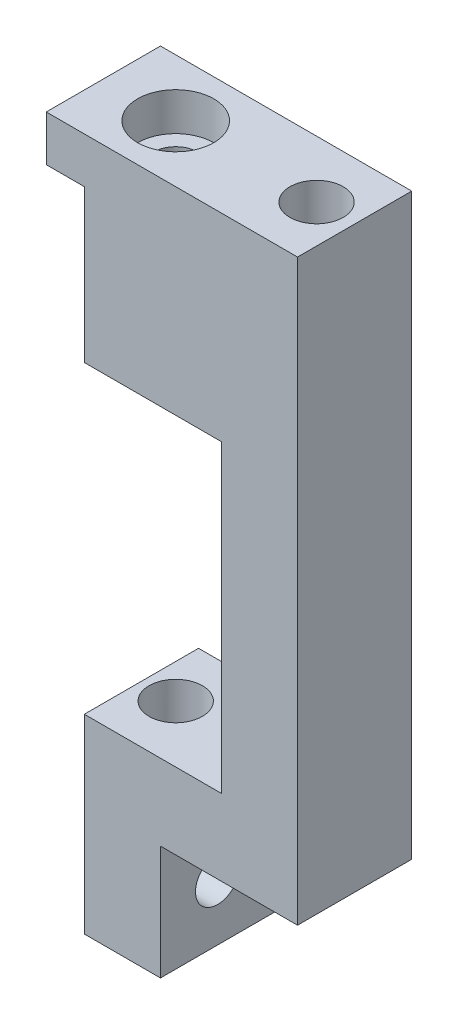
from build123d import *

# Parameters (mm, degrees)
BOSS_EXTRUDE1_DEPTH          = 7.5
CUT_EXTRUDE1_REACH           = 158.924
SKETCH2_W                    = 18
SKETCH2_H                    = 40
M5_CLEARANCE_HOLE1_D         = 5.8
CUT_EXTRUDE2_REACH           = 158.924
F_7_0_7_DIAMETER_HOLE1_D     = 7
F_7_0_7_DIAMETER_HOLE1_DEPTH = 20
MOVE_FACE1_BY                = 0.6
CUT_EXTRUDE3_REACH           = 141.732
SKETCH14_W                   = 15
SKETCH14_H                   = 15
BOSS_EXTRUDE2_DEPTH          = 10
M5_CLEARANCE_HOLE2_D         = 5.8
SKETCH18_W                   = 33
SKETCH18_H                   = 15
SKETCH18_R                   = 5
BOSS_EXTRUDE3_DEPTH          = 6
SKETCH19_R                   = 5
SKETCH19_R_2                 = 2.9
BOSS_EXTRUDE4_DEPTH          = 1
F_7_0_7_DIAMETER_HOLE2_D     = 7
F_7_0_7_DIAMETER_HOLE2_DEPTH = 30


with BuildPart() as part:
    # Sketch1 → Boss-Extrude1 (new, symmetric)
    with BuildSketch(Plane.XY):
        Polygon((0, 0), (120, 0), (0, -100), align=None)
    extrude(amount=BOSS_EXTRUDE1_DEPTH, both=True)

    # Sketch2 → Cut-Extrude1 (cut, up to next)
    with BuildSketch(Plane.XY.offset(7.5), mode=Mode.PRIVATE) as cut_extrude1_sk1:
        with Locations((9, -40)):
            Rectangle(SKETCH2_W, SKETCH2_H)
    cut_extrude1_tool1 = extrude(cut_extrude1_sk1.sketch, amount=-CUT_EXTRUDE1_REACH, mode=Mode.PRIVATE) & part.part
    add(cut_extrude1_tool1.solids().sort_by_distance((9, -40, 7.5))[0], mode=Mode.SUBTRACT)

    # M5 Clearance Hole1 (through all)
    with Locations(Plane(origin=(0, 0, 0), x_dir=(1, 0, 0), z_dir=(0, 1, 0))):
        with Locations((4.5, 0)):
            Hole(M5_CLEARANCE_HOLE1_D / 2)

    # Sketch8 → Cut-Extrude2 (cut, up to next)
    with BuildSketch(Plane.XY.offset(7.5), mode=Mode.PRIVATE) as cut_extrude2_sk1:
        Polygon((0, -70), (36, -70), (0, -100), align=None)
    cut_extrude2_tool1 = extrude(cut_extrude2_sk1.sketch, amount=-CUT_EXTRUDE2_REACH, mode=Mode.PRIVATE) & part.part
    add(cut_extrude2_tool1.solids().sort_by_distance((12, -80, 7.5))[0], mode=Mode.SUBTRACT)

    # Ø7.0 (7) Diameter Hole1
    with Locations(Plane(origin=(0, 0, 0), x_dir=(1, 0, 0), z_dir=(0, 1, 0))):
        with Locations((60, 0)):
            Hole(F_7_0_7_DIAMETER_HOLE1_D / 2, depth=F_7_0_7_DIAMETER_HOLE1_DEPTH)

    # Move Face1: a curved face moved inward by 0.6
    add(Solid.thicken(part.faces().sort_by_distance((7.4, -65, 0))[0], -MOVE_FACE1_BY), mode=Mode.SUBTRACT)

    # Sketch13 → Cut-Extrude3 (cut, up to next)
    with BuildSketch(Plane.XY.offset(7.5), mode=Mode.PRIVATE) as cut_extrude3_sk1:
        Polygon((28, 0), (28, -70), (36, -70), (120, 0), align=None)
    cut_extrude3_tool1 = extrude(cut_extrude3_sk1.sketch, amount=-CUT_EXTRUDE3_REACH, mode=Mode.PRIVATE) & part.part
    add(cut_extrude3_tool1.solids().sort_by_distance((58.88, -25.2, 7.5))[0], mode=Mode.SUBTRACT)

    # Sketch14 → Boss-Extrude2 (add)
    with BuildSketch(Plane.ZY):
        with Locations((0, -77.5)):
            Rectangle(SKETCH14_W, SKETCH14_H)
    extrude(amount=-BOSS_EXTRUDE2_DEPTH)

    # M5 Clearance Hole2 (through all)
    with Locations(Plane(origin=(10, 0, 0), x_dir=(0, 0, -1), z_dir=(1, 0, 0))):
        with Locations((0, -77.5)):
            Hole(M5_CLEARANCE_HOLE2_D / 2)



with BuildPart() as body_2:
    # Sketch18 → Boss-Extrude3 (new body)
    with BuildSketch(Plane(origin=(0, 0, 0), x_dir=(1, 0, 0), z_dir=(0, 1, 0))):
        with Locations((11.5, 0)):
            Rectangle(SKETCH18_W, SKETCH18_H)
        with Locations(Location((4.5, 0, 0), (0, 0, 270))):
            Circle(SKETCH18_R, mode=Mode.SUBTRACT)
    extrude(amount=BOSS_EXTRUDE3_DEPTH)


with BuildPart() as part_1:
    add(part.part)

    add(body_2.part)  # Boss-Extrude4 merges body 2
    # Sketch19 → Boss-Extrude4 (add)
    with BuildSketch(Plane(origin=(0, 0, 0), x_dir=(1, 0, 0), z_dir=(0, 1, 0))):
        with Locations(Location((4.5, 0, 0), (0, 0, 270))):
            Circle(SKETCH19_R)
        with Locations(Location((4.5, 0, 0), (0, 0, 270))):
            Circle(SKETCH19_R_2, mode=Mode.SUBTRACT)
    extrude(amount=BOSS_EXTRUDE4_DEPTH)

    # Ø7.0 (7) Diameter Hole2
    with Locations(Plane(origin=(0, 6, 0), x_dir=(1, 0, 0), z_dir=(0, 1, 0))):
        with Locations((23, 0)):
            Hole(F_7_0_7_DIAMETER_HOLE2_D / 2, depth=F_7_0_7_DIAMETER_HOLE2_DEPTH)


solid = part_1.part
